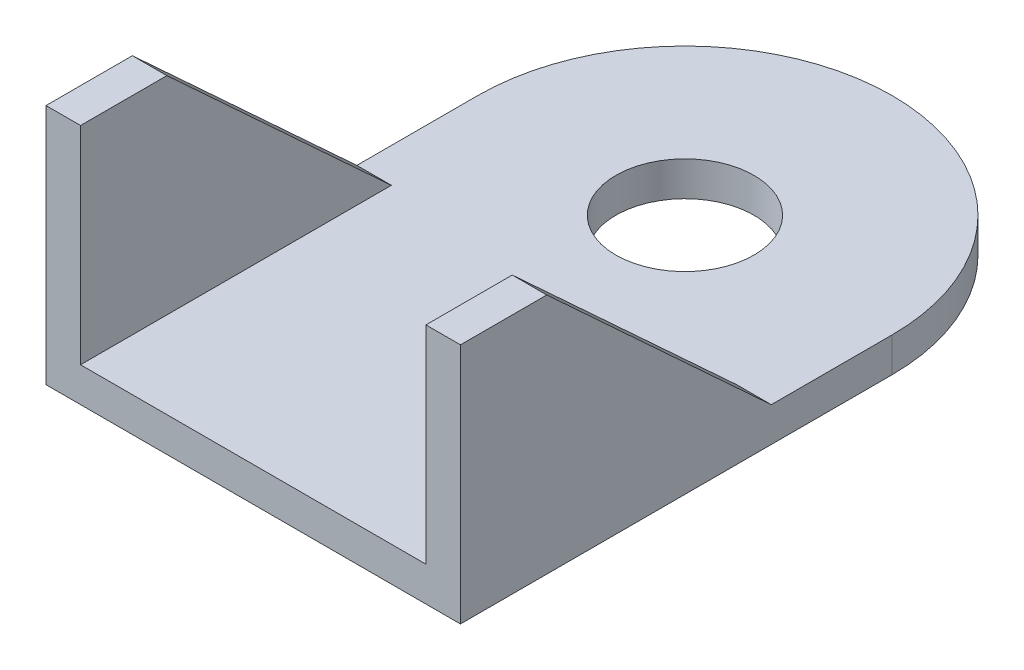
from build123d import *

# Parameters (mm, degrees)
SKETCH_1_R      = 12
SKETCH_1_R_2    = 4
EXTRUDE_1_DEPTH = 2
EXTRUDE_2_DEPTH = 2


with BuildPart() as part:
    # 草图1 → 凸台-拉伸1 (new body)
    # profile 1 of 2: a face of its own
    with BuildSketch(Plane(origin=(0, 0, 0), x_dir=(1, 0, 0), z_dir=(0, 1, 0))):
        Circle(SKETCH_1_R)
        with Locations(Location((0, 0, 0), (0, 0, 270))):
            Circle(SKETCH_1_R_2, mode=Mode.SUBTRACT)
    # profile 2 of 2: a face of its own
    with BuildSketch(Plane(origin=(0, 0, 0), x_dir=(1, 0, 0), z_dir=(0, 1, 0))):
        with BuildLine():
            ThreePointArc((12, 0), (0, -12), (-12, 0))
            Line((-12, 0), (-12, -25))
            Line((-12, -25), (12, -25))
            Line((12, -25), (12, 0))
        make_face()
    extrude(amount=EXTRUDE_1_DEPTH)

    # 草图3 → 凸台-拉伸2 (add)
    with BuildSketch(Plane(origin=(12, 0, 0), x_dir=(0, 0, -1), z_dir=(1, 0, 0))):
        Polygon((-25, 2), (-25, 14), (-20, 14), (-7, 2), align=None)
    extrude_2 = extrude(amount=-EXTRUDE_2_DEPTH)

    # 镜向1: 凸台-拉伸2 across plane
    add(extrude_2.mirror(Plane(origin=(0, 0, 0), x_dir=(0, 0, 1), z_dir=(1, 0, 0))))


solid = part.part
